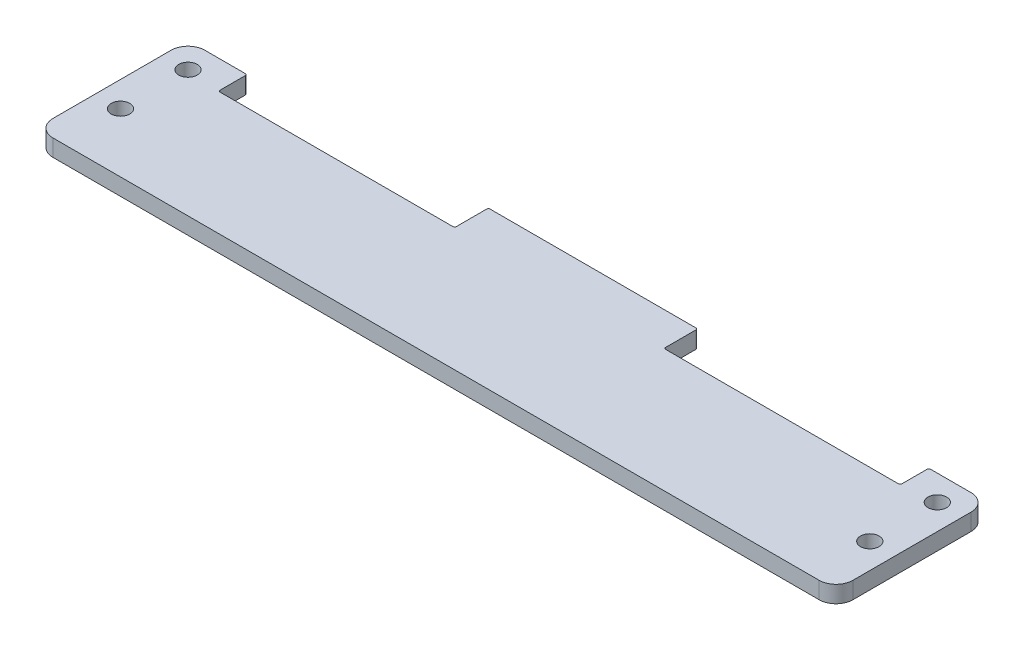
from build123d import *

# Parameters (mm, degrees)
BOSS_EXTRUDE1_DEPTH  = 5
M5_CLEARANCE_HOLE1_D = 5.5
FILLET1_R            = 5
FILLET2_R            = 0.5


with BuildPart() as part:
    # Sketch1 → Boss-Extrude1 (new body)
    with BuildSketch(Plane(origin=(0, 0, 0), x_dir=(1, 0, 0), z_dir=(0, 1, 0))):
        Polygon((-118.5, 0), (118.5, 0), (118.5, 45), (101, 45), (101, 36.5), (31, 36.5), (31, 46.5), (-31, 46.5), (-31, 36.5), (-101, 36.5), (-101, 45), (-118.5, 45), align=None)
    extrude(amount=-BOSS_EXTRUDE1_DEPTH)

    # M5 Clearance Hole1 (through all)
    with Locations(Plane(origin=(0, 0, 0), x_dir=(1, 0, 0), z_dir=(0, 1, 0))):
        with Locations((-111, 37.5), (-111, 17.5), (111, 37.5), (111, 17.5)):
            Hole(M5_CLEARANCE_HOLE1_D / 2)

    # Fillet1
    fillet1_edges = [part.edges().sort_by_distance(p)[0] for p in [
        (-118.5, -2.5, -45),
        (118.5, -2.5, -45),
        (118.5, -2.5, 0),
        (-118.5, -2.5, 0),
    ]]
    fillet(fillet1_edges, radius=FILLET1_R)

    # Fillet2
    fillet2_edges = [part.edges().sort_by_distance(p)[0] for p in [
        (-101, -2.5, -45),
        (-101, -2.5, -36.5),
        (-31, -2.5, -36.5),
        (-31, -2.5, -46.5),
        (31, -2.5, -46.5),
        (31, -2.5, -36.5),
        (101, -2.5, -36.5),
        (101, -2.5, -45),
    ]]
    fillet(fillet2_edges, radius=FILLET2_R)


solid = part.part
